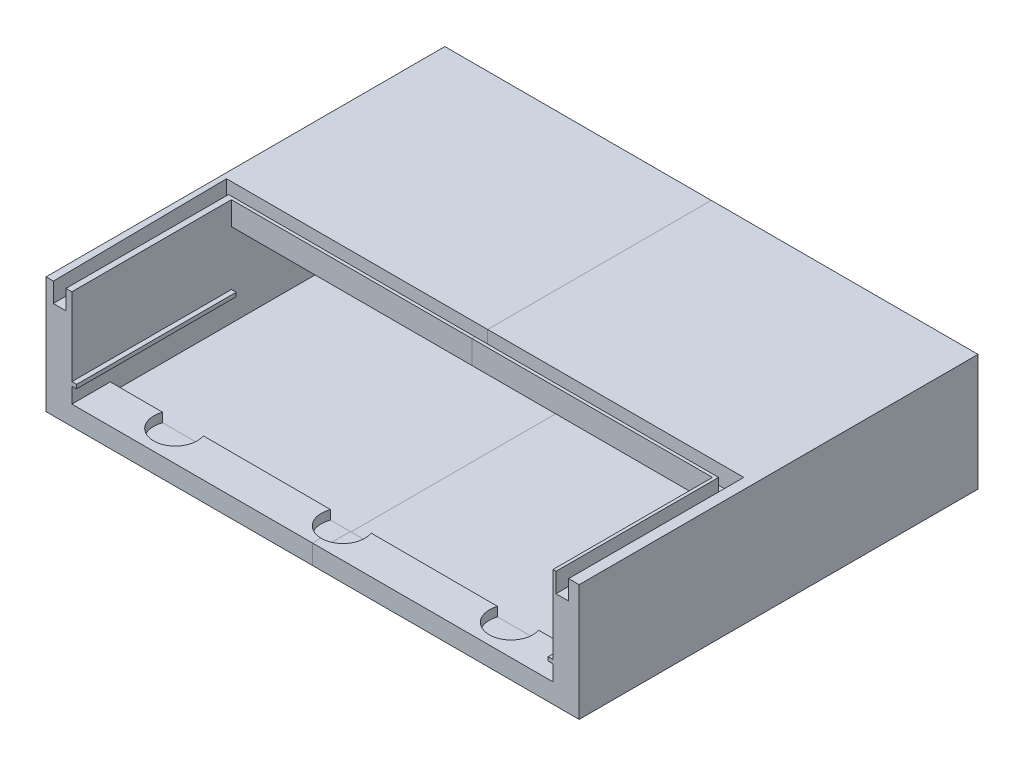
from build123d import *

# Parameters (mm, degrees)
BOSS_EXTRUDE1_DEPTH    = 60
CUT_EXTRUDE1_DEPTH     = 10
SKETCH5_W              = 247.25
SKETCH5_H              = 82
CUT_EXTRUDE2_DEPTH     = 50
SKETCH6_R              = 11.15
CUT_EXTRUDE3_DEPTH     = 4.66
CUT_EXTRUDE4_DEPTH     = 5
SKETCH9_W              = 2.428238535
SKETCH9_H              = 2
BOSS_EXTRUDE3_DEPTH    = 85
SKETCH11_W             = 247.25
SKETCH11_H             = 38
CUT_EXTRUDE6_DEPTH     = 109
SPLIT3_SURFACE_1_BACK  = 348.434
SPLIT3_SURFACE_1_DEPTH = 696.868
SPLIT3_SURFACE_2_BACK  = 348.434
SPLIT3_SURFACE_2_DEPTH = 696.868


with BuildPart() as part:
    # Sketch1 → Boss-Extrude1 (new body)
    with BuildSketch(Plane(origin=(0, 0, 0), x_dir=(1, 0, 0), z_dir=(0, 1, 0))):
        Polygon((263, -90), (0, -90), (-5.297672508, -90), (-5.297672508, 115), (268.719836564, 115), (268.719836564, 109.817232955), (268.719836564, 5.622236561), (268.719836564, -90), align=None)
    extrude(amount=BOSS_EXTRUDE1_DEPTH)

    # Sketch4 → Cut-Extrude1 (cut)
    with BuildSketch(Plane(origin=(0, 60, 0), x_dir=(1, 0, 0), z_dir=(0, 1, 0))):
        Polygon((-1.518607935, -90.000001141), (4.981392065, -90), (4.981392065, -6.438755439), (256.811190639, -6.438755439), (256.811190639, -90), (263.311190639, -90), (263.311190639, 0.061244561), (-2.567831993, 0.061244561), align=None)
    extrude(amount=-CUT_EXTRUDE1_DEPTH, mode=Mode.SUBTRACT)

    # Sketch5 → Cut-Extrude2 (cut)
    with BuildSketch(Plane(origin=(0, 60, 0), x_dir=(1, 0, 0), z_dir=(0, 1, 0))):
        with Locations((131.625, -49)):
            Rectangle(SKETCH5_W, SKETCH5_H)
    extrude(amount=-CUT_EXTRUDE2_DEPTH, mode=Mode.SUBTRACT)

    # Sketch6 → Cut-Extrude3 (cut)
    with BuildSketch(Plane(origin=(0, 10, 0), x_dir=(1, 0, 0), z_dir=(0, 1, 0))):
        with Locations(Location((131.857766281, -74.522104322, 0), (0, 0, 270))):
            Circle(SKETCH6_R)
        with Locations(Location((45.409631344, -74.22492571, 0), (0, 0, 270))):
            Circle(SKETCH6_R)
        with Locations(Location((217.983549657, -74.264123819, 0), (0, 0, 270))):
            Circle(SKETCH6_R)
    extrude(amount=-CUT_EXTRUDE3_DEPTH, mode=Mode.SUBTRACT)

    # Sketch7 → Cut-Extrude4 (cut)
    with BuildSketch(Plane(origin=(0, 10, 0), x_dir=(1, 0, 0), z_dir=(0, 1, 0))):
        Polygon((8, -70.253012436), (8, 98.962802173), (255.25, 98.962802173), (255.25, -70.717283821), align=None)
    extrude(amount=-CUT_EXTRUDE4_DEPTH, mode=Mode.SUBTRACT)

    # Sketch9 → Boss-Extrude3 (add)
    with BuildSketch(Plane.XY.offset(90)):
        with Locations((9.214119267, 19)):
            Rectangle(SKETCH9_W, SKETCH9_H)
    boss_extrude3 = extrude(amount=-BOSS_EXTRUDE3_DEPTH)

    # Mirror1: Boss-Extrude3 across plane
    add(boss_extrude3.mirror(Plane(origin=(131.625, 0, 0), x_dir=(0, 0, 1), z_dir=(1, 0, 0))))

    # Sketch11 → Cut-Extrude6 (cut)
    with BuildSketch(Plane.XY.offset(8)):
        with Locations((131.625, 29)):
            Rectangle(SKETCH11_W, SKETCH11_H)
    extrude(amount=-CUT_EXTRUDE6_DEPTH, mode=Mode.SUBTRACT)


with BuildPart() as body_2:
    # Split3: the piece behind the surface
    add(part.part)
    # Split3 surface: a surface, the sketch's curves swept straight by 696.868 mm
    with BuildLine(Plane.XY.offset(-101).offset(-SPLIT3_SURFACE_1_BACK), mode=Mode.PRIVATE) as split3_surface_1_path:
        Line((131.625, 38.021015206), (131.625, 59.950755183))
        Line((131.625, 59.950755183), (131.625, 64.27398998))
        Line((131.625, 64.27398998), (-5.297672508, 64.27398998))
        Line((-5.297672508, 64.27398998), (-5.297672508, 0))
        Line((-5.297672508, 0), (131.625, -0.05437829))
        Line((131.625, -0.05437829), (131.625, 24.579650238))
        Line((131.625, 24.579650238), (142.996381437, 18.014380104))
        Line((142.996381437, 18.014380104), (142.996381437, 44.58628534))
        Line((142.996381437, 44.58628534), (131.625, 38.021015206))
    split3_surface_1 = Shell.extrude(split3_surface_1_path.wire(), (0 * SPLIT3_SURFACE_1_DEPTH, 0 * SPLIT3_SURFACE_1_DEPTH, 1 * SPLIT3_SURFACE_1_DEPTH))
    split(bisect_by=split3_surface_1, keep=Keep.BOTTOM)


with BuildPart() as part_1:
    add(part.part)

    # Split3: split by a surface, the side it looks to stays
    # Split3 surface: a surface, the sketch's curves swept straight by 696.868 mm
    with BuildLine(Plane.XY.offset(-101).offset(-SPLIT3_SURFACE_2_BACK), mode=Mode.PRIVATE) as split3_surface_2_path:
        Line((131.625, 38.021015206), (131.625, 59.950755183))
        Line((131.625, 59.950755183), (131.625, 64.27398998))
        Line((131.625, 64.27398998), (-5.297672508, 64.27398998))
        Line((-5.297672508, 64.27398998), (-5.297672508, 0))
        Line((-5.297672508, 0), (131.625, -0.05437829))
        Line((131.625, -0.05437829), (131.625, 24.579650238))
        Line((131.625, 24.579650238), (142.996381437, 18.014380104))
        Line((142.996381437, 18.014380104), (142.996381437, 44.58628534))
        Line((142.996381437, 44.58628534), (131.625, 38.021015206))
    split3_surface_2 = Shell.extrude(split3_surface_2_path.wire(), (0 * SPLIT3_SURFACE_2_DEPTH, 0 * SPLIT3_SURFACE_2_DEPTH, 1 * SPLIT3_SURFACE_2_DEPTH))
    split(bisect_by=split3_surface_2, keep=Keep.TOP)


solid = Compound([body_2.part, part_1.part])
